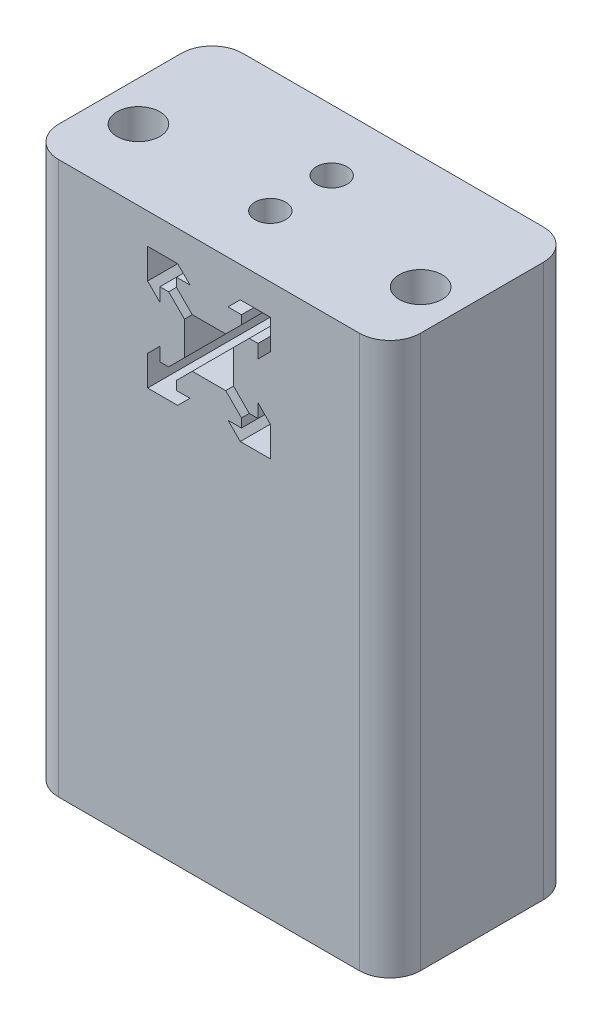
from build123d import *

# Parameters (mm, degrees)
SKETCH1_W           = 59
SKETCH1_H           = 30
BOSS_EXTRUDE1_DEPTH = 30
SKETCH2_R           = 2.5
SKETCH2_R_2         = 3.5
CUT_EXTRUDE1_DEPTH  = 52.674461778
SKETCH3_W           = 59
SKETCH3_H           = 60
BOSS_EXTRUDE2_DEPTH = 30
FILLET1_R           = 5
FILLET2_R           = 5
FILLET3_R           = 5
FILLET4_R           = 5


with BuildPart() as part:
    # Sketch1 → Boss-Extrude1 (new body)
    with BuildSketch(Plane.XY):
        Rectangle(SKETCH1_W, SKETCH1_H)
        Polygon((4, 2.727207794), (6.572792206, 5.3), (8, 5.3), (8, 3.1), (10, 5.1), (10, 10), (5.1, 10), (3.1, 8), (5.3, 8), (5.3, 6.572792206), (2.727207794, 4), (-2.727207794, 4), (-5.3, 6.572792206), (-5.3, 8), (-3.1, 8), (-5.1, 10), (-10, 10), (-10, 5.1), (-8, 3.1), (-8, 5.3), (-6.572792206, 5.3), (-4, 2.727207794), (-4, -2.727207794), (-6.572792206, -5.3), (-8, -5.3), (-8, -3.1), (-10, -5.1), (-10, -10), (-5.1, -10), (-3.1, -8), (-5.3, -8), (-5.3, -6.572792206), (-2.727207794, -4), (2.727207794, -4), (5.3, -6.572792206), (5.3, -8), (3.1, -8), (5.1, -10), (10, -10), (10, -5.1), (8, -3.1), (8, -5.3), (6.572792206, -5.3), (4, -2.727207794), align=None, mode=Mode.SUBTRACT)
    extrude(amount=-BOSS_EXTRUDE1_DEPTH)

    # Sketch2 → Cut-Extrude1 (cut, through all)
    with BuildSketch(Plane(origin=(0, 15, 0), x_dir=(1, 0, 0), z_dir=(0, 1, 0))):
        with Locations(Location((0, 10, 0), (0, 0, 270))):
            Circle(SKETCH2_R)
        with Locations(Location((0, 20, 0), (0, 0, 270))):
            Circle(SKETCH2_R)
        with Locations(Location((23, 11.5, 0), (0, 0, 270))):
            Circle(SKETCH2_R_2)
        with Locations(Location((-23, 11.5, 0), (0, 0, 270))):
            Circle(SKETCH2_R_2)
    extrude(amount=-CUT_EXTRUDE1_DEPTH, mode=Mode.SUBTRACT)

    # Sketch3 → Boss-Extrude2 (add)
    with BuildSketch(Plane.XY):
        with Locations((0, -45)):
            Rectangle(SKETCH3_W, SKETCH3_H)
    extrude(amount=-BOSS_EXTRUDE2_DEPTH)

    # Fillet1
    fillet1_edges = [part.edges().sort_by_distance(p)[0] for p in [
        (29.5, -30, 0),
    ]]
    fillet(fillet1_edges, radius=FILLET1_R)

    # Fillet2
    fillet2_edges = [part.edges().sort_by_distance(p)[0] for p in [
        (29.5, -30, -30),
    ]]
    fillet(fillet2_edges, radius=FILLET2_R)

    # Fillet3
    fillet3_edges = [part.edges().sort_by_distance(p)[0] for p in [
        (-29.5, -30, -30),
    ]]
    fillet(fillet3_edges, radius=FILLET3_R)

    # Fillet4
    fillet4_edges = [part.edges().sort_by_distance(p)[0] for p in [
        (-29.5, -30, 0),
    ]]
    fillet(fillet4_edges, radius=FILLET4_R)


solid = part.part
